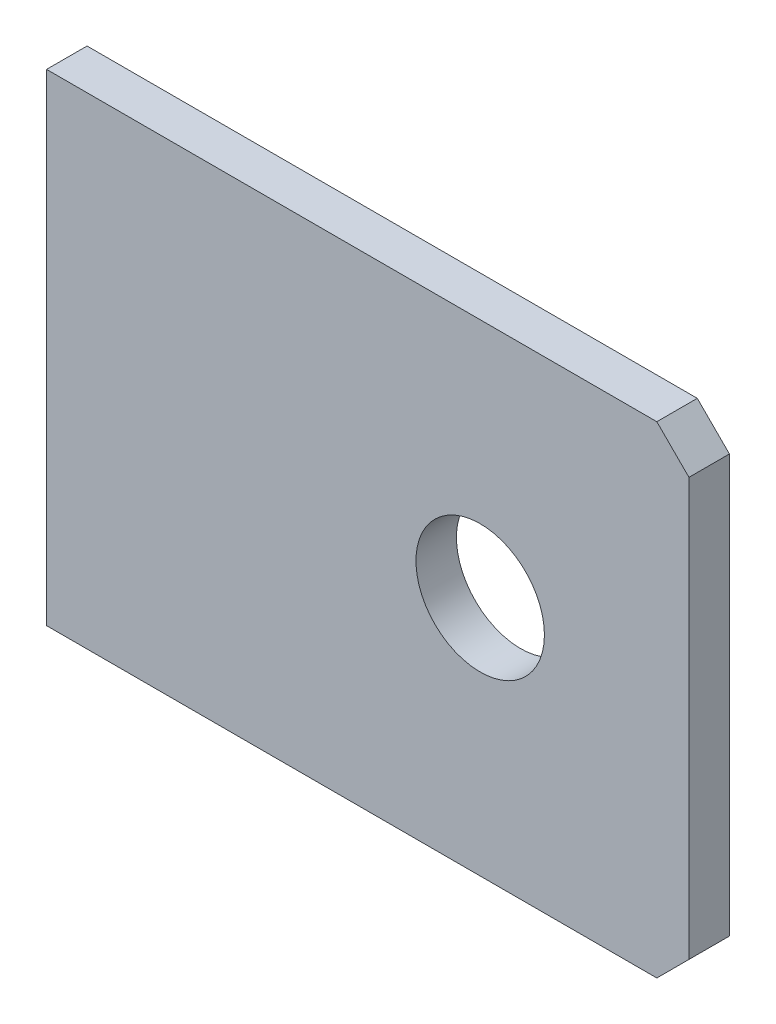
from build123d import *

# Parameters (mm, degrees)
ESBO_O1_R                = 2
RESSALTO_EXTRUS_O1_DEPTH = 1.26


with BuildPart() as part:
    # Esboço1 → Ressalto-extrusão1 (new body)
    with BuildSketch(Plane.XY):
        Polygon((10, -6.5), (10, 6.5), (9, 7.5), (-10, 7.5), (-10, -7.5), (9, -7.5), align=None)
        with Locations((3.5, 0)):
            Circle(ESBO_O1_R, mode=Mode.SUBTRACT)
    extrude(amount=RESSALTO_EXTRUS_O1_DEPTH)


solid = part.part
